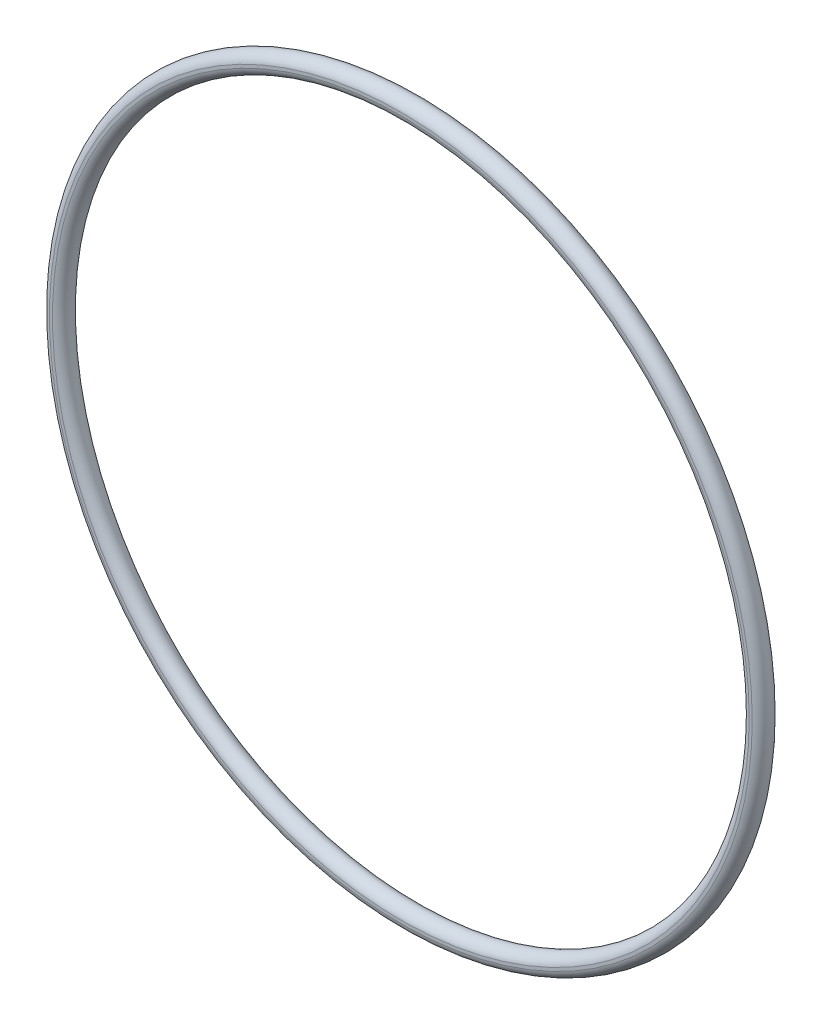
from build123d import *

# Parameters (mm, degrees)
SKETCH1_W = 0.804271402
SKETCH1_H = 5.273016548


with BuildPart() as part:
    # Sketch1 → Revolve1 (revolve)
    with BuildSketch(Plane(origin=(0, 0, 0), x_dir=(0, -1, 0), z_dir=(1, 0, 0)), mode=Mode.PRIVATE) as revolve1_sk:
        with BuildLine():
            ThreePointArc((91.304564299, 2.636508274), (89.0397, 0), (91.304564299, -2.636508274))
            Line((91.304564299, -2.636508274), (91.304564299, 2.636508274))
        make_face()
        with Locations((91.7067, 0)):
            Rectangle(SKETCH1_W, SKETCH1_H)
        with BuildLine():
            Line((92.108835701, 2.636508274), (92.108835701, -2.636508274))
            ThreePointArc((92.108835701, -2.636508274), (93.729740399, -1.737871268), (94.3737, 0))
            ThreePointArc((94.3737, 0), (93.729740399, 1.737871268), (92.108835701, 2.636508274))
        make_face()
    revolve(revolve1_sk.sketch.rotate(Axis((0, 0, 2.667), (0, 0, -1)), 270), axis=Axis((0, 0, 2.667), (0, 0, -1)))


solid = part.part
